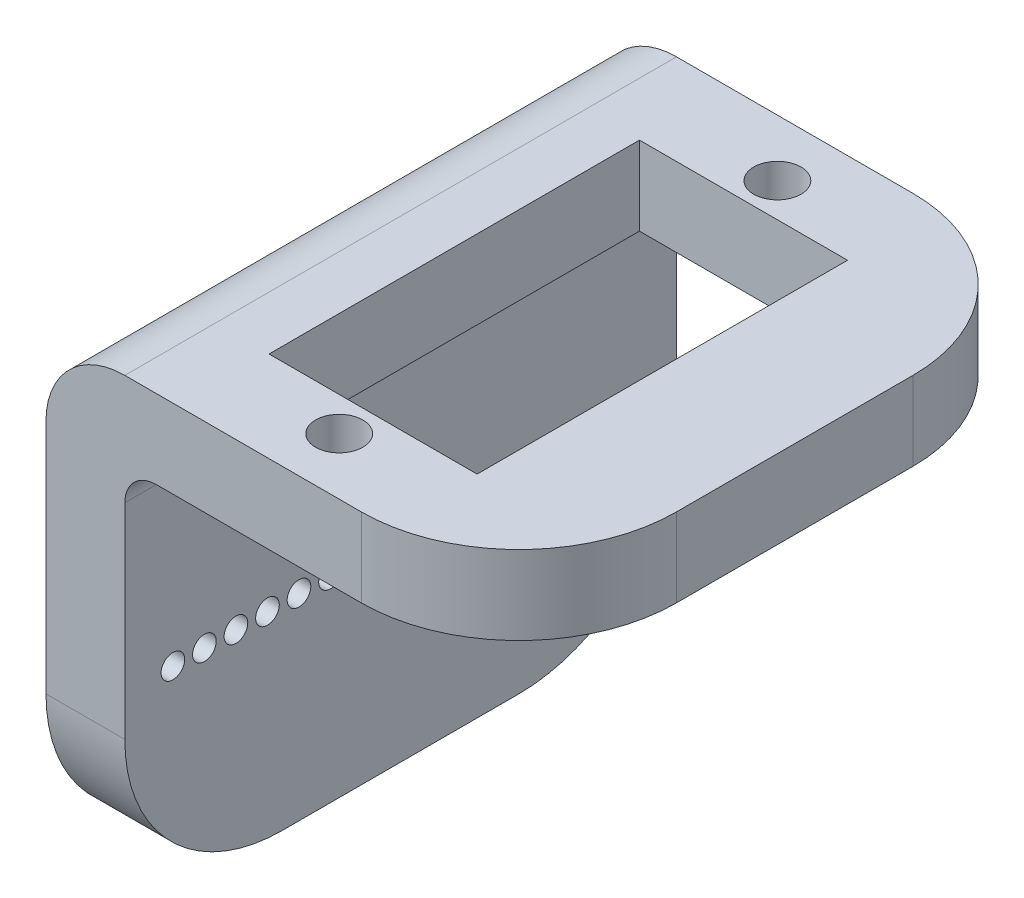
from build123d import *

# Parameters (mm, degrees)
SKETCH1_W           = 35
SKETCH1_H           = 25
SKETCH1_R           = 0.75
BOSS_EXTRUDE1_DEPTH = 5
SKETCH4_W           = 30
SKETCH4_H           = 35
BOSS_EXTRUDE2_DEPTH = 5
CUT_EXTRUDE2_REACH  = 47.894
SKETCH3_R           = 1.5
SKETCH3_W           = 23.5
SKETCH3_H           = 13.2
FILLET1_R           = 10
FILLET2_R           = 5
FILLET3_R           = 2
FILLET4_R           = 10


with BuildPart() as part:
    # Sketch1 → Boss-Extrude1 (new body)
    with BuildSketch(Plane(origin=(0, 0, 0), x_dir=(0, 0, -1), z_dir=(1, 0, 0))):
        Rectangle(SKETCH1_W, SKETCH1_H)
        with Locations((-14.45, 0)):
            Circle(SKETCH1_R, mode=Mode.SUBTRACT)
        with Locations((-12.45, 0)):
            Circle(SKETCH1_R, mode=Mode.SUBTRACT)
        with Locations((-10.45, 0)):
            Circle(SKETCH1_R, mode=Mode.SUBTRACT)
        with Locations((-8.45, 0)):
            Circle(SKETCH1_R, mode=Mode.SUBTRACT)
        with Locations((-6.45, 0)):
            Circle(SKETCH1_R, mode=Mode.SUBTRACT)
        with Locations((-4.45, 0)):
            Circle(SKETCH1_R, mode=Mode.SUBTRACT)
        with Locations((4.45, 0)):
            Circle(SKETCH1_R, mode=Mode.SUBTRACT)
        with Locations((6.45, 0)):
            Circle(SKETCH1_R, mode=Mode.SUBTRACT)
        with Locations((8.45, 0)):
            Circle(SKETCH1_R, mode=Mode.SUBTRACT)
        with Locations((10.45, 0)):
            Circle(SKETCH1_R, mode=Mode.SUBTRACT)
        with Locations((12.45, 0)):
            Circle(SKETCH1_R, mode=Mode.SUBTRACT)
        with Locations((14.45, 0)):
            Circle(SKETCH1_R, mode=Mode.SUBTRACT)
    extrude(amount=BOSS_EXTRUDE1_DEPTH)

    # Sketch4 → Boss-Extrude2 (add)
    with BuildSketch(Plane(origin=(0, 12.5, 0), x_dir=(1, 0, 0), z_dir=(0, 1, 0))):
        with Locations((15, 0)):
            Rectangle(SKETCH4_W, SKETCH4_H)
    extrude(amount=BOSS_EXTRUDE2_DEPTH)

    # Sketch3 → Cut-Extrude2 (cut, up to next)
    with BuildSketch(Plane(origin=(30, 17.5, 0), x_dir=(0, 0, -1), z_dir=(0, 1, 0)), mode=Mode.PRIVATE) as cut_extrude2_sk1:
        with Locations((13.9, 15)):
            Circle(SKETCH3_R)
    cut_extrude2_tool1 = extrude(cut_extrude2_sk1.sketch, amount=-CUT_EXTRUDE2_REACH, mode=Mode.PRIVATE) & part.part
    # Sketch3 → Cut-Extrude2 (cut, up to next)
    with BuildSketch(Plane(origin=(30, 17.5, 0), x_dir=(0, 0, -1), z_dir=(0, 1, 0)), mode=Mode.PRIVATE) as cut_extrude2_sk2:
        with Locations((-13.9, 15)):
            Circle(SKETCH3_R)
    cut_extrude2_tool2 = extrude(cut_extrude2_sk2.sketch, amount=-CUT_EXTRUDE2_REACH, mode=Mode.PRIVATE) & part.part
    # Sketch3 → Cut-Extrude2 (cut, up to next)
    with BuildSketch(Plane(origin=(30, 17.5, 0), x_dir=(0, 0, -1), z_dir=(0, 1, 0)), mode=Mode.PRIVATE) as cut_extrude2_sk3:
        with Locations((0, 15)):
            Rectangle(SKETCH3_W, SKETCH3_H)
    cut_extrude2_tool3 = extrude(cut_extrude2_sk3.sketch, amount=-CUT_EXTRUDE2_REACH, mode=Mode.PRIVATE) & part.part
    add(cut_extrude2_tool1.solids().sort_by_distance((15, 17.5, -13.9))[0], mode=Mode.SUBTRACT)
    add(cut_extrude2_tool2.solids().sort_by_distance((15, 17.5, 13.9))[0], mode=Mode.SUBTRACT)
    add(cut_extrude2_tool3.solids().sort_by_distance((15, 17.5, 0))[0], mode=Mode.SUBTRACT)

    # Fillet1
    fillet1_edges = [part.edges().sort_by_distance(p)[0] for p in [
        (30, 15, -17.5),
        (30, 15, 17.5),
    ]]
    fillet(fillet1_edges, radius=FILLET1_R)

    # Fillet2
    fillet2_edges = [part.edges().sort_by_distance(p)[0] for p in [
        (0, 17.5, 0),
    ]]
    fillet(fillet2_edges, radius=FILLET2_R)

    # Fillet3
    fillet3_edges = [part.edges().sort_by_distance(p)[0] for p in [
        (5, 12.5, 0),
    ]]
    fillet(fillet3_edges, radius=FILLET3_R)

    # Fillet4
    fillet4_edges = [part.edges().sort_by_distance(p)[0] for p in [
        (2.5, -12.5, -17.5),
        (2.5, -12.5, 17.5),
    ]]
    fillet(fillet4_edges, radius=FILLET4_R)


solid = part.part
